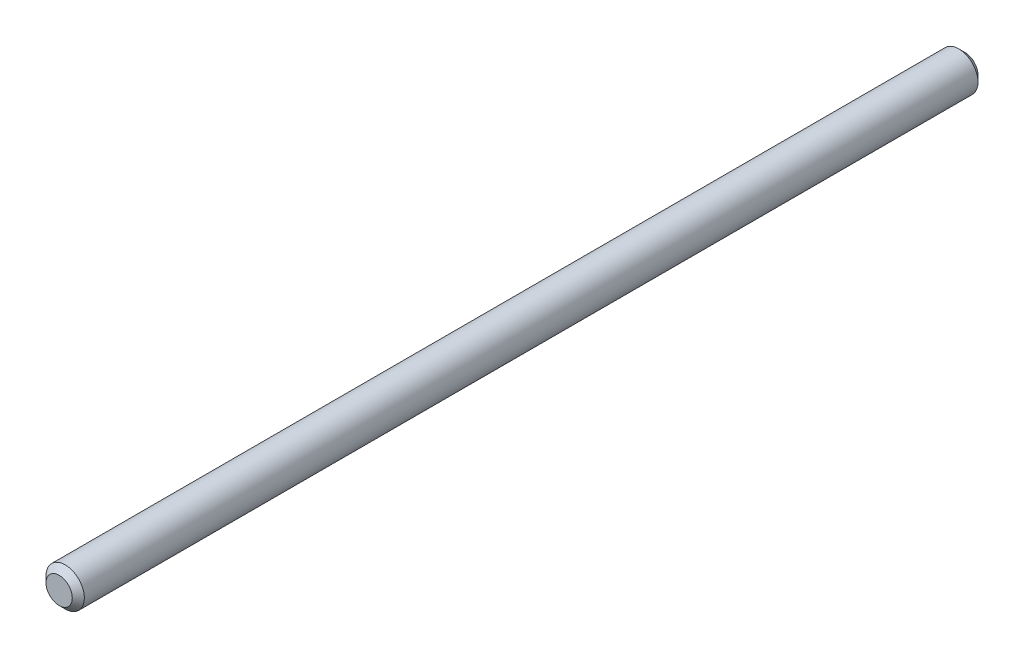
from build123d import *

# Parameters (mm, degrees)
SKETCH1_R           = 3.175
BOSS_EXTRUDE1_DEPTH = 75
CHAMFER1_SIZE       = 1


with BuildPart() as part:
    # Sketch1 → Boss-Extrude1 (new, symmetric)
    with BuildSketch(Plane.XY):
        Circle(SKETCH1_R)
    extrude(amount=BOSS_EXTRUDE1_DEPTH, both=True)

    # Chamfer1
    chamfer1_edges = [part.edges().sort_by_distance(p)[0] for p in [
        (-3.175, 0, -75),
        (-3.175, 0, 75),
    ]]
    chamfer(chamfer1_edges, length=CHAMFER1_SIZE)


solid = part.part
